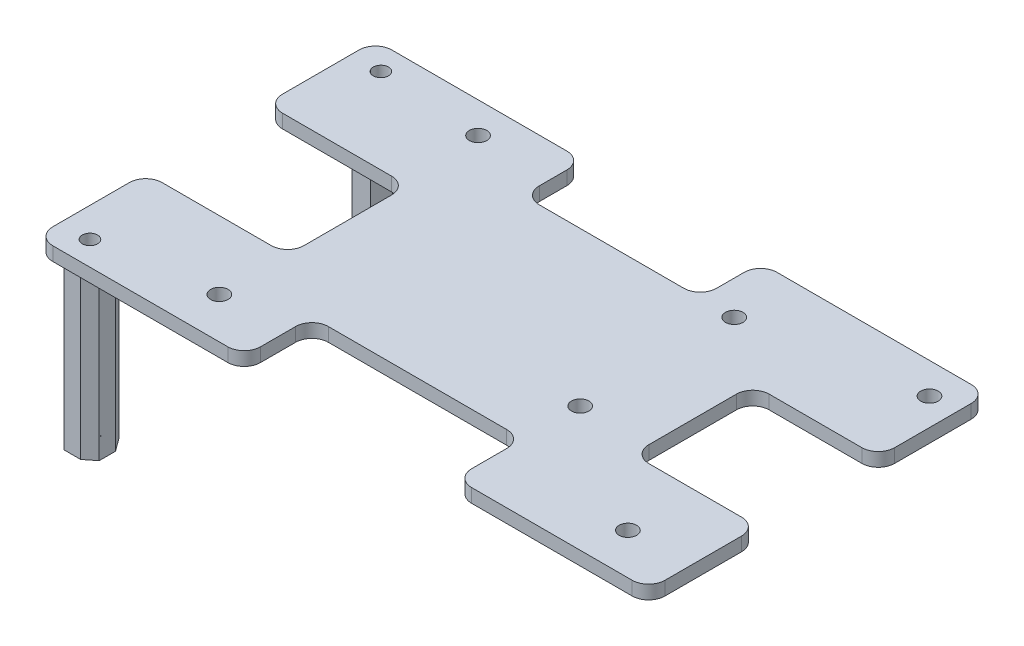
from build123d import *

# Parameters (mm, degrees)
CROQUIS1_R              = 1.6
CROQUIS1_R_2            = 1.4
SALIENTE_EXTRUIR1_DEPTH = 2.5
SALIENTE_EXTRUIR2_START = -32.5
CROQUIS2_R              = 1.4
SALIENTE_EXTRUIR2_DEPTH = 32.5


with BuildPart() as part:
    # Croquis1 → Saliente-Extruir1 (new body)
    with BuildSketch(Plane(origin=(0, 0, 0), x_dir=(1, 0, 0), z_dir=(0, 1, 0))):
        with BuildLine():
            Line((-54.475, -31), (-22.475, -31))
            ThreePointArc((-22.475, -31), (-20.353679656, -30.121320344), (-19.475, -28))
            Line((-19.475, -28), (-19.475, -21.598648019))
            ThreePointArc((-19.475, -21.598648019), (-18.596320344, -19.477327676), (-16.475, -18.598648019))
            Line((-16.475, -18.598648019), (16.135, -18.598648019))
            ThreePointArc((16.135, -18.598648019), (18.256320344, -19.477327676), (19.135, -21.598648019))
            Line((19.135, -21.598648019), (19.135, -28))
            ThreePointArc((19.135, -28), (20.013679656, -30.121320344), (22.135, -31))
            Line((22.135, -31), (51.475, -31))
            ThreePointArc((51.475, -31), (53.596320344, -30.121320344), (54.475, -28))
            Line((54.475, -28), (54.475, -14))
            ThreePointArc((54.475, -14), (53.596320344, -11.878679656), (51.475, -11))
            Line((51.475, -11), (34.52775179, -11))
            ThreePointArc((34.52775179, -11), (32.406431446, -10.121320344), (31.52775179, -8))
            Line((31.52775179, -8), (31.52775179, 8))
            ThreePointArc((31.52775179, 8), (32.406431446, 10.121320344), (34.52775179, 11))
            Line((34.52775179, 11), (51.475, 11))
            ThreePointArc((51.475, 11), (53.596320344, 11.878679656), (54.475, 14))
            Line((54.475, 14), (54.475, 28))
            ThreePointArc((54.475, 28), (53.596320344, 30.121320344), (51.475, 31))
            Line((51.475, 31), (15.953577615, 31))
            ThreePointArc((15.953577615, 31), (13.832257271, 30.121320344), (12.953577615, 28))
            Line((12.953577615, 28), (12.953577615, 22.9600001))
            ThreePointArc((12.953577615, 22.9600001), (12.074897958, 20.838679756), (9.953577615, 19.9600001))
            Line((9.953577615, 19.9600001), (-16.475, 19.9600001))
            ThreePointArc((-16.475, 19.9600001), (-18.596320344, 20.838679756), (-19.475, 22.9600001))
            Line((-19.475, 22.9600001), (-19.475, 28))
            ThreePointArc((-19.475, 28), (-20.353679656, 30.121320344), (-22.475, 31))
            Line((-22.475, 31), (-54.475, 31))
            ThreePointArc((-54.475, 31), (-56.596320344, 30.121320344), (-57.475, 28))
            Line((-57.475, 28), (-57.475, 14))
            ThreePointArc((-57.475, 14), (-56.596320344, 11.878679656), (-54.475, 11))
            Line((-54.475, 11), (-34.52775179, 11))
            ThreePointArc((-34.52775179, 11), (-32.406431446, 10.121320344), (-31.52775179, 8))
            Line((-31.52775179, 8), (-31.52775179, -8))
            ThreePointArc((-31.52775179, -8), (-32.406431446, -10.121320344), (-34.52775179, -11))
            Line((-34.52775179, -11), (-54.475, -11))
            ThreePointArc((-54.475, -11), (-56.596320344, -11.878679656), (-57.475, -14))
            Line((-57.475, -14), (-57.475, -28))
            ThreePointArc((-57.475, -28), (-56.596320344, -30.121320344), (-54.475, -31))
        make_face()
        with Locations(Location((49.495, 25.3400001, 0), (0, 0, 270))):
            Circle(CROQUIS1_R, mode=Mode.SUBTRACT)
        with Locations(Location((-52.075, 26.6, 0), (0, 0, 270))):
            Circle(CROQUIS1_R_2, mode=Mode.SUBTRACT)
        with Locations(Location((-52.075, -26.6, 0), (0, 0, 90))):
            Circle(CROQUIS1_R_2, mode=Mode.SUBTRACT)
        with Locations(Location((-33.04775179, 25.3400001, 0), (0, 0, 270))):
            Circle(CROQUIS1_R, mode=Mode.SUBTRACT)
        with Locations(Location((19.175, 19.9600001, 0), (0, 0, 270))):
            Circle(CROQUIS1_R, mode=Mode.SUBTRACT)
        with Locations(Location((43.175, -23.4799999, 0), (0, 0, 270))):
            Circle(CROQUIS1_R, mode=Mode.SUBTRACT)
        with Locations(Location((-31.52775179, -23.4799999, 0), (0, 0, 270))):
            Circle(CROQUIS1_R, mode=Mode.SUBTRACT)
        with Locations(Location((19.135, -8.1599999, 0), (0, 0, 270))):
            Circle(CROQUIS1_R, mode=Mode.SUBTRACT)
    extrude(amount=SALIENTE_EXTRUIR1_DEPTH)

    # Croquis2 → Saliente-Extruir2 (add)
    # profile 1 of 2: a face of its own
    with BuildSketch(Plane(origin=(0, 2.5, 0), x_dir=(1, 0, 0), z_dir=(0, 1, 0)).offset(SALIENTE_EXTRUIR2_START)):
        Polygon((-55.475, 27.9), (-53.575, 29.8), (-50.575, 29.8), (-48.686440257, 28.294279871), (-48.686440257, 25.304374216), (-50.388696536, 23.00255261), (-53.761303464, 23.00255261), (-55.475, 24.9), align=None)
        with Locations(Location((-52.075, 26.6, 0), (0, 0, 270))):
            Circle(CROQUIS2_R, mode=Mode.SUBTRACT)
    # profile 2 of 2: a face of its own
    with BuildSketch(Plane(origin=(0, 2.5, 0), x_dir=(1, 0, 0), z_dir=(0, 1, 0)).offset(SALIENTE_EXTRUIR2_START)):
        Polygon((-55.475, -27.9), (-53.575, -29.8), (-50.575, -29.8), (-48.686440257, -28.294279871), (-48.686440257, -25.304374216), (-50.388696536, -23.00255261), (-53.761303464, -23.00255261), (-55.475, -24.9), align=None)
        with Locations(Location((-52.075, -26.6, 0), (0, 0, 90))):
            Circle(CROQUIS2_R, mode=Mode.SUBTRACT)
    extrude(amount=SALIENTE_EXTRUIR2_DEPTH)


solid = part.part
